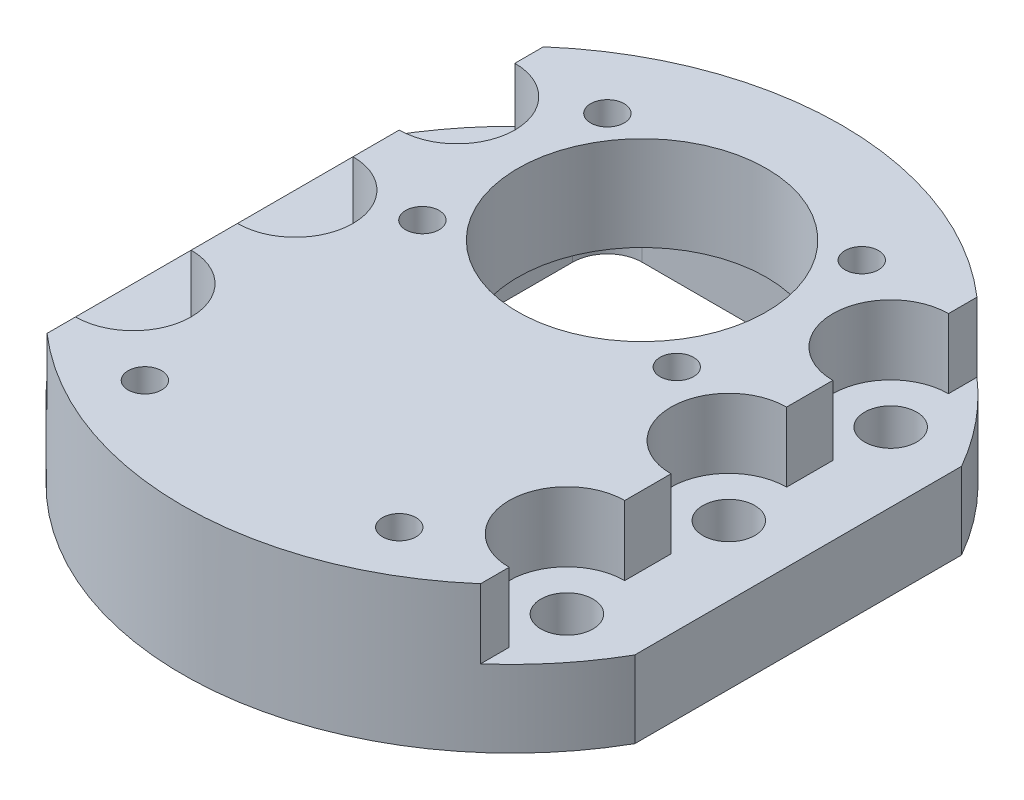
from build123d import *

# Parameters (mm, degrees)
SCHIZZO3_R                   = 2.25
ESTRUSIONE_ESTRUSIONE1_DEPTH = 12.65
SCHIZZO1_R                   = 3
TAGLIO_ESTRUSIONE1_DEPTH     = 4.5
SCHIZZO4_R                   = 10.75
SCHIZZO4_R_2                 = 1.45
TAGLIO_ESTRUSIONE2_DEPTH     = 48.529438246
SCHIZZO6_R                   = 5
TAGLIO_ESTRUSIONE3_DEPTH     = 6
SCHIZZO7_W                   = 16
SCHIZZO7_H                   = 77
TAGLIO_ESTRUSIONE4_DEPTH     = 6


with BuildPart() as part:
    # Schizzo3 → Estrusione-Estrusione1 (new body)
    with BuildSketch(Plane(origin=(0, 0, 0), x_dir=(1, 0, 0), z_dir=(0, 1, 0))):
        with BuildLine():
            Line((-24.75, 2.881082761), (-24.75, -25.381082761))
            ThreePointArc((-24.75, -25.381082761), (0, -39.75), (24.75, -25.381082761))
            Line((24.75, -25.381082761), (24.75, 2.881082761))
            ThreePointArc((24.75, 2.881082761), (0, 17.25), (-24.75, 2.881082761))
        make_face()
        with Locations(Location((-18.75, 2.75, 0), (0, 0, 270))):
            Circle(SCHIZZO3_R, mode=Mode.SUBTRACT)
        with Locations(Location((18.75, 2.75, 0), (0, 0, 90))):
            Circle(SCHIZZO3_R, mode=Mode.SUBTRACT)
        with Locations(Location((18.75, -25.25, 0), (0, 0, 270))):
            Circle(SCHIZZO3_R, mode=Mode.SUBTRACT)
        with Locations(Location((-18.75, -25.25, 0), (0, 0, 90))):
            Circle(SCHIZZO3_R, mode=Mode.SUBTRACT)
        with Locations(Location((-18.75, -11.25, 0), (0, 0, 270))):
            Circle(SCHIZZO3_R, mode=Mode.SUBTRACT)
        with Locations(Location((18.75, -11.25, 0), (0, 0, 90))):
            Circle(SCHIZZO3_R, mode=Mode.SUBTRACT)
    extrude(amount=ESTRUSIONE_ESTRUSIONE1_DEPTH)

    # Schizzo1 → Taglio-Estrusione1 (cut)
    with BuildSketch(Plane(origin=(0, 0, 0), x_dir=(1, 0, 0), z_dir=(0, 1, 0))):
        with Locations(Location((-11, -32, 0), (0, 0, 270))):
            Circle(SCHIZZO1_R)
        with Locations(Location((11, -32, 0), (0, 0, 90))):
            Circle(SCHIZZO1_R)
        with BuildLine():
            Line((-14, 8), (-14, -8))
            ThreePointArc((-14, -8), (-13.121320344, -10.121320344), (-11, -11))
            Line((-11, -11), (0, -11))
            Line((0, -11), (11, -11))
            ThreePointArc((11, -11), (13.121320344, -10.121320344), (14, -8))
            Line((14, -8), (14, 8))
            ThreePointArc((14, 8), (13.121320344, 10.121320344), (11, 11))
            Line((11, 11), (0, 11))
            Line((0, 11), (-11, 11))
            ThreePointArc((-11, 11), (-13.121320344, 10.121320344), (-14, 8))
        make_face()
    extrude(amount=TAGLIO_ESTRUSIONE1_DEPTH, mode=Mode.SUBTRACT)

    # Schizzo4 → Taglio-Estrusione2 (cut, through all)
    with BuildSketch(Plane.XZ.offset(-4.5)):
        with Locations(Location((0, 0, 0), (0, 0, 270))):
            Circle(SCHIZZO4_R)
        with Locations(Location((-11, 8, 0), (0, 0, 270))):
            Circle(SCHIZZO4_R_2)
        with Locations(Location((-11, -8, 0), (0, 0, 270))):
            Circle(SCHIZZO4_R_2)
        with Locations(Location((11, -8, 0), (0, 0, 270))):
            Circle(SCHIZZO4_R_2)
        with Locations(Location((11, 8, 0), (0, 0, 270))):
            Circle(SCHIZZO4_R_2)
        with Locations(Location((-11, 32, 0), (0, 0, 270))):
            Circle(SCHIZZO4_R_2)
        with Locations(Location((11, 32, 0), (0, 0, 270))):
            Circle(SCHIZZO4_R_2)
    extrude(amount=-TAGLIO_ESTRUSIONE2_DEPTH, mode=Mode.SUBTRACT)

    # Schizzo6 → Taglio-Estrusione3 (cut)
    with BuildSketch(Plane(origin=(0, 12.65, 0), x_dir=(1, 0, 0), z_dir=(0, 1, 0))):
        with Locations(Location((-18.75, 2.75, 0), (0, 0, 270))):
            Circle(SCHIZZO6_R)
        with Locations(Location((-18.75, -11.25, 0), (0, 0, 270))):
            Circle(SCHIZZO6_R)
        with Locations(Location((-18.75, -25.25, 0), (0, 0, 270))):
            Circle(SCHIZZO6_R)
        with Locations(Location((18.75, -25.25, 0), (0, 0, 270))):
            Circle(SCHIZZO6_R)
        with Locations(Location((18.75, -11.25, 0), (0, 0, 270))):
            Circle(SCHIZZO6_R)
        with Locations(Location((18.75, 2.75, 0), (0, 0, 270))):
            Circle(SCHIZZO6_R)
    extrude(amount=-TAGLIO_ESTRUSIONE3_DEPTH, mode=Mode.SUBTRACT)

    # Schizzo7 → Taglio-Estrusione4 (cut)
    with BuildSketch(Plane(origin=(0, 12.65, 0), x_dir=(1, 0, 0), z_dir=(0, 1, 0))):
        with Locations((-26.75, -11.25)):
            Rectangle(SCHIZZO7_W, SCHIZZO7_H)
        with Locations((26.75, -11.25)):
            Rectangle(SCHIZZO7_W, SCHIZZO7_H)
    extrude(amount=-TAGLIO_ESTRUSIONE4_DEPTH, mode=Mode.SUBTRACT)


solid = part.part
